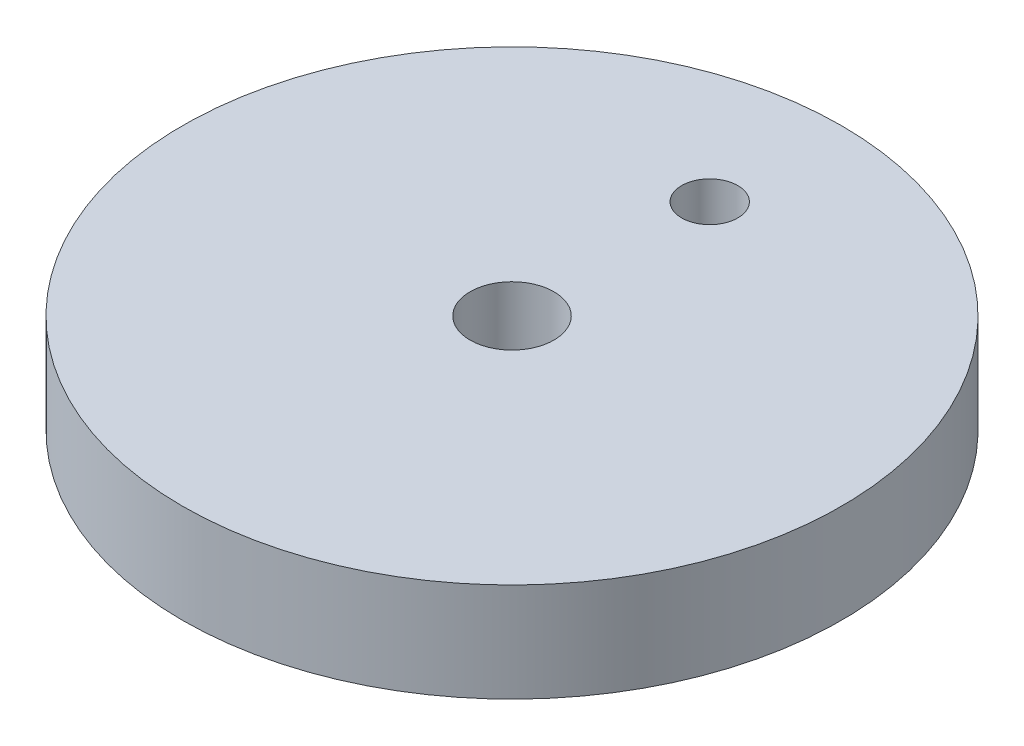
from build123d import *

# Parameters (mm, degrees)
SKETCH1_R              = 15.875
BOSS_EXTRUDE1_DEPTH    = 4.7625
F_10_32_TAPPED_HOLE1_D = 4.0386
F_6_32_TAPPED_HOLE1_D  = 2.7051


with BuildPart() as part:
    # Sketch1 → Boss-Extrude1 (new body)
    with BuildSketch(Plane(origin=(0, 0, 0), x_dir=(1, 0, 0), z_dir=(0, 1, 0))):
        with Locations(Location((0, 0, 0), (0, 0, 90))):
            Circle(SKETCH1_R)
    extrude(amount=BOSS_EXTRUDE1_DEPTH)

    # #10-32 Tapped Hole1 (through all)
    with Locations(Plane(origin=(0, 4.7625, 0), x_dir=(1, 0, 0), z_dir=(0, 1, 0))):
        with Locations((0, 0)):
            Hole(F_10_32_TAPPED_HOLE1_D / 2)

    # #6-32 Tapped Hole1 (through all)
    with Locations(Plane(origin=(0, 4.7625, 0), x_dir=(1, 0, 0), z_dir=(0, 1, 0))):
        with Locations((0, 9.525)):
            Hole(F_6_32_TAPPED_HOLE1_D / 2)


solid = part.part
